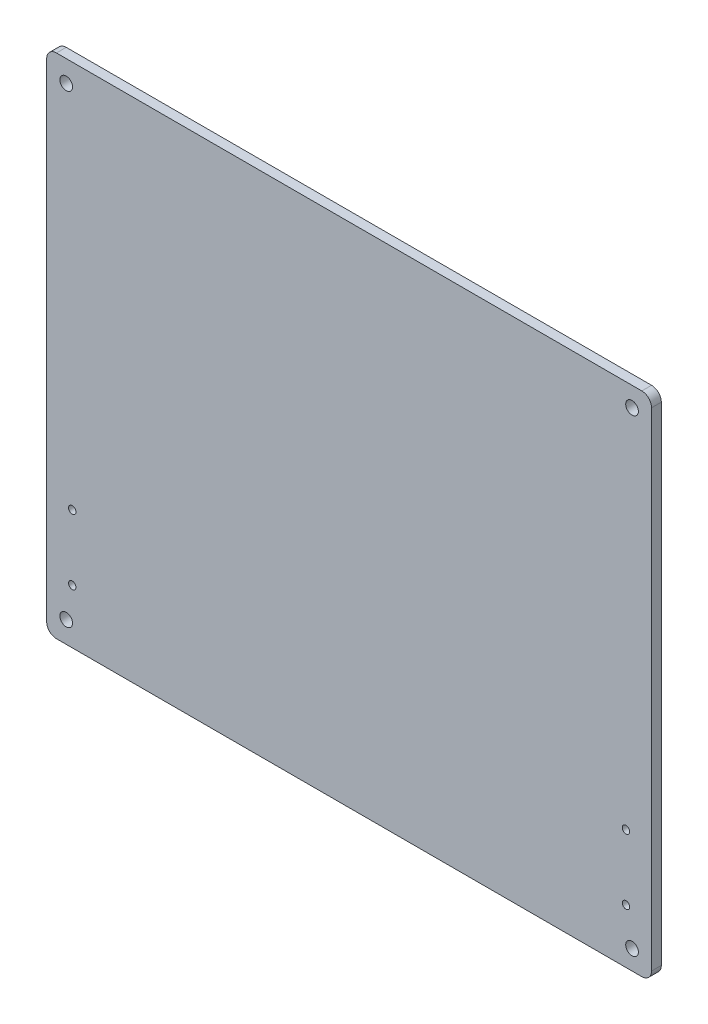
from build123d import *

# Parameters (mm, degrees)
SKETCH1_R           = 3.25
SKETCH1_R_2         = 1.9
BOSS_EXTRUDE1_DEPTH = 5


with BuildPart() as part:
    # Sketch1 → Boss-Extrude1 (new body)
    with BuildSketch(Plane.XY):
        with BuildLine():
            Line((-295, -10), (5, -10))
            ThreePointArc((5, -10), (8.535533906, -8.535533906), (10, -5))
            Line((10, -5), (10, 245))
            ThreePointArc((10, 245), (8.535533906, 248.535533906), (5, 250))
            Line((5, 250), (-295, 250))
            ThreePointArc((-295, 250), (-298.535533906, 248.535533906), (-300, 245))
            Line((-300, 245), (-300, -5))
            ThreePointArc((-300, -5), (-298.535533906, -8.535533906), (-295, -10))
        make_face()
        Circle(SKETCH1_R, mode=Mode.SUBTRACT)
        with Locations((0, 240)):
            Circle(SKETCH1_R, mode=Mode.SUBTRACT)
        with Locations((-290, 239)):
            Circle(SKETCH1_R, mode=Mode.SUBTRACT)
        with Locations((-290, 1)):
            Circle(SKETCH1_R, mode=Mode.SUBTRACT)
        with Locations(Location((-286.899999971, 51.217380491, 0), (0, 0, 180))):
            Circle(SKETCH1_R_2, mode=Mode.SUBTRACT)
        with Locations(Location((-286.899999971, 17.782619509, 0), (0, 0, 180))):
            Circle(SKETCH1_R_2, mode=Mode.SUBTRACT)
        with Locations((-3.100000029, 17.782619509)):
            Circle(SKETCH1_R_2, mode=Mode.SUBTRACT)
        with Locations((-3.100000029, 51.217380491)):
            Circle(SKETCH1_R_2, mode=Mode.SUBTRACT)
    extrude(amount=BOSS_EXTRUDE1_DEPTH)


solid = part.part
